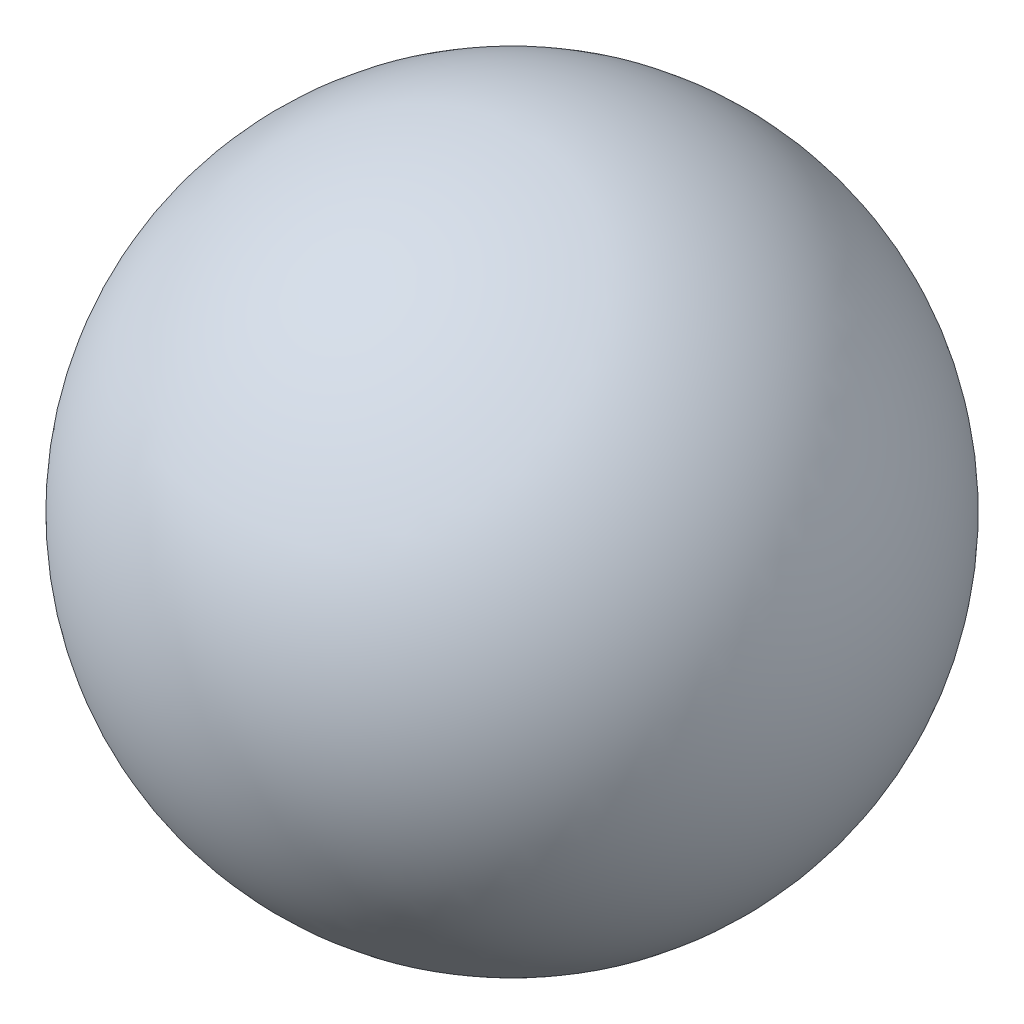
from build123d import *


with BuildPart() as part:
    # 草图1 → 旋转1 (revolve)
    with BuildSketch(Plane.XY):
        with BuildLine():
            Line((0, 123), (0, -123))
            ThreePointArc((0, -123), (123, 0), (0, 123))
        make_face()
    revolve(axis=Axis((0, 123, 0), (0, -1, 0)))


solid = part.part
